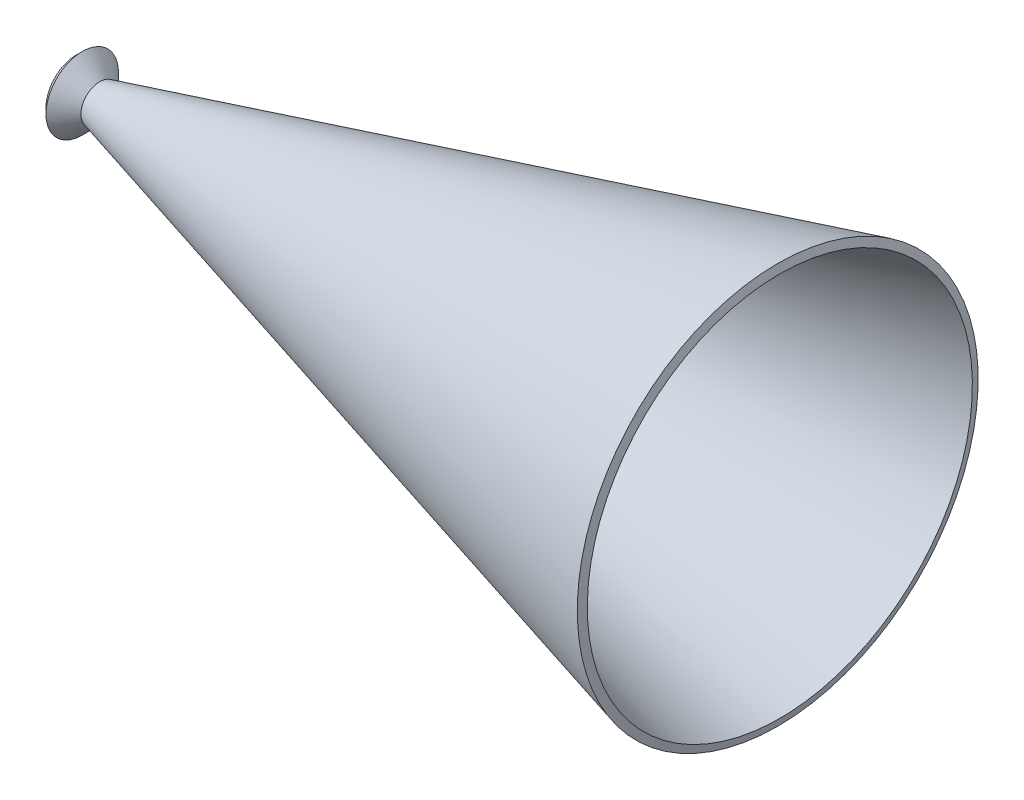
from build123d import *


with BuildPart() as part:
    # Schizzo1 → Rivoluzione1 (revolve)
    with BuildSketch(Plane.XY, mode=Mode.PRIVATE) as rivoluzione1_sk:
        Polygon((-12.7, 18.5733), (0, 5.8733), (416.5, 117.474138648), (415.205904774, 122.303767779), (1.494292454, 11.450075358), (-9.164466094, 22.108833906), align=None)
    revolve(rivoluzione1_sk.sketch.rotate(Axis((-119.967242997, 0, 0), (1, 0, 0)), 180), axis=Axis((-119.967242997, 0, 0), (1, 0, 0)))


solid = part.part
